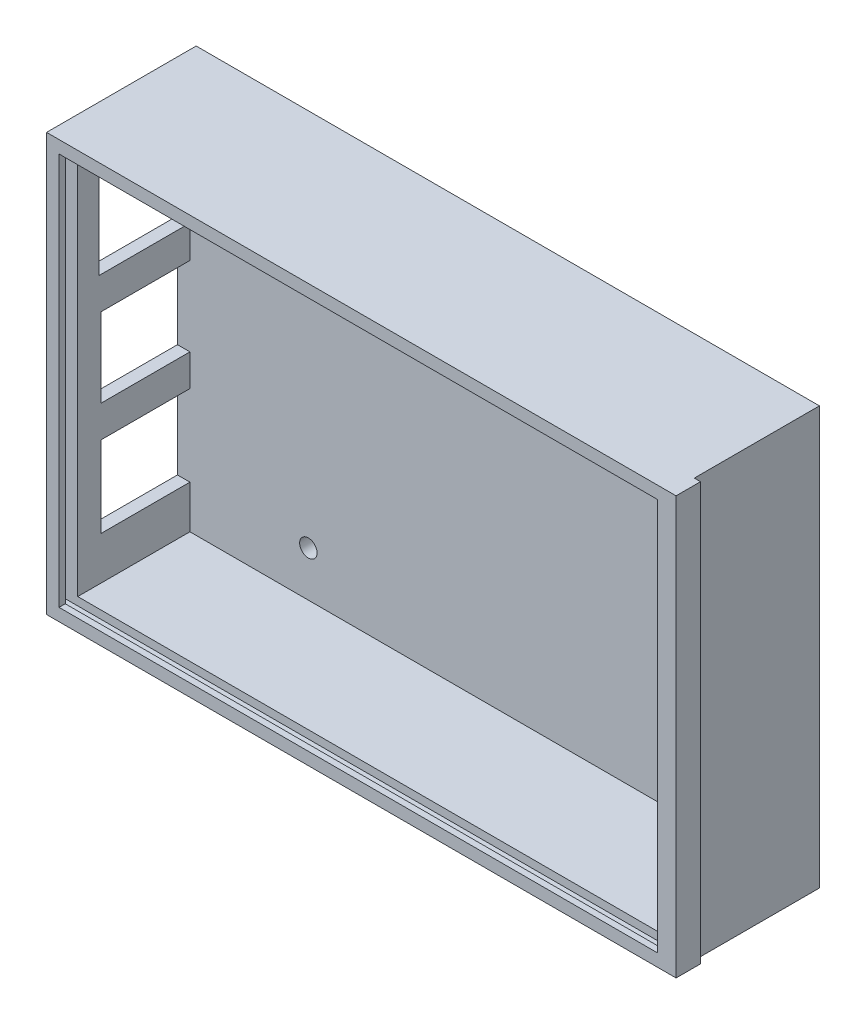
from build123d import *

# Parameters (mm, degrees)
SKETCH2_W           = 100
SKETCH2_H           = 67
BOSS_EXTRUDE1_DEPTH = 3
SKETCH3_W           = 100
SKETCH3_H           = 67
BOSS_EXTRUDE2_DEPTH = 21
SKETCH4_W           = 96
SKETCH4_H           = 63
CUT_EXTRUDE1_DEPTH  = 21
SKETCH5_R           = 1.4
CUT_EXTRUDE2_DEPTH  = 3
SKETCH9_W           = 14.3
SKETCH9_H           = 13
SKETCH9_H_2         = 12.7
SKETCH9_W_2         = 14.6
SKETCH9_H_3         = 15.3
CUT_EXTRUDE5_DEPTH  = 2
CUT_EXTRUDE7_START  = -100
SKETCH12_W          = 2
SKETCH12_H          = 65.6
CUT_EXTRUDE7_DEPTH  = 100
SKETCH16_W          = 3.920339225
SKETCH16_H          = 67
BOSS_EXTRUDE3_DEPTH = 1


with BuildPart() as part:
    # Sketch2 → Boss-Extrude1 (new body)
    with BuildSketch(Plane.XY):
        Rectangle(SKETCH2_W, SKETCH2_H)
    extrude(amount=BOSS_EXTRUDE1_DEPTH)

    # Sketch3 → Boss-Extrude2 (add)
    with BuildSketch(Plane.XY.offset(3)):
        Rectangle(SKETCH3_W, SKETCH3_H)
    extrude(amount=BOSS_EXTRUDE2_DEPTH)

    # Sketch4 → Cut-Extrude1 (cut)
    with BuildSketch(Plane.XY.offset(24)):
        Rectangle(SKETCH4_W, SKETCH4_H)
    extrude(amount=-CUT_EXTRUDE1_DEPTH, mode=Mode.SUBTRACT)

    # Sketch5 → Cut-Extrude2 (cut)
    with BuildSketch(Plane.XY.offset(3)):
        with Locations((-29, 24.25)):
            Circle(SKETCH5_R)
        with Locations((29, 24.25)):
            Circle(SKETCH5_R)
        with Locations((29, -24.25)):
            Circle(SKETCH5_R)
        with Locations((-29, -24.25)):
            Circle(SKETCH5_R)
    extrude(amount=-CUT_EXTRUDE2_DEPTH, mode=Mode.SUBTRACT)

    # Sketch9 → Cut-Extrude5 (cut)
    with BuildSketch(Plane.ZY.offset(50)):
        with Locations((10.15, -18.1)):
            Rectangle(SKETCH9_W, SKETCH9_H)
        with Locations((10.15, -0.15)):
            Rectangle(SKETCH9_W, SKETCH9_H_2)
        with Locations((10.3, 19.05)):
            Rectangle(SKETCH9_W_2, SKETCH9_H_3)
    extrude(amount=-CUT_EXTRUDE5_DEPTH, mode=Mode.SUBTRACT)

    # Sketch12 → Cut-Extrude7 (cut)
    with BuildSketch(Plane(origin=(50, 0, 0), x_dir=(0, 0, -1), z_dir=(1, 0, 0)).offset(CUT_EXTRUDE7_START)):
        with Locations((-22, 0)):
            Rectangle(SKETCH12_W, SKETCH12_H)
    extrude(amount=CUT_EXTRUDE7_DEPTH, mode=Mode.SUBTRACT)

    # Sketch16 → Boss-Extrude3 (add)
    with BuildSketch(Plane(origin=(50, 0, 0), x_dir=(0, 0, -1), z_dir=(1, 0, 0))):
        with Locations((-22.039830388, 0)):
            Rectangle(SKETCH16_W, SKETCH16_H)
    extrude(amount=BOSS_EXTRUDE3_DEPTH)


solid = part.part
